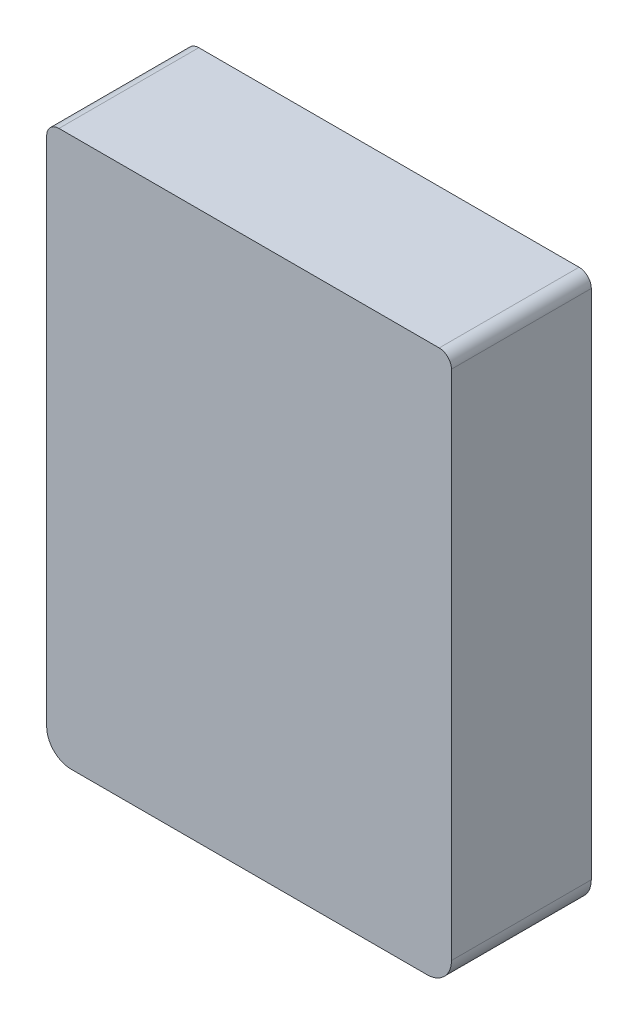
from build123d import *

# Parameters (mm, degrees)
BOSS_EXTRUDE1_DEPTH = 22.8


with BuildPart() as part:
    # Sketch1 → Boss-Extrude1 (new body)
    with BuildSketch(Plane.XY):
        with BuildLine():
            Line((28, 250), (28, 307.5))
            ThreePointArc((28, 307.5), (28.585786438, 308.914213563), (30, 309.5))
            Line((30, 309.5), (30.5, 309.5))
            Line((30.5, 309.5), (91.5, 309.5))
            Line((91.5, 309.5), (92, 309.5))
            ThreePointArc((92, 309.5), (93.414213562, 308.914213563), (94, 307.5))
            Line((94, 307.5), (94, 250))
            Line((94, 250), (94, 224))
            ThreePointArc((94, 224), (92.828427125, 221.171572875), (90, 220))
            Line((90, 220), (32, 220))
            ThreePointArc((32, 220), (29.171572875, 221.171572875), (28, 224))
            Line((28, 224), (28, 250))
        make_face()
    extrude(amount=BOSS_EXTRUDE1_DEPTH)


solid = part.part
